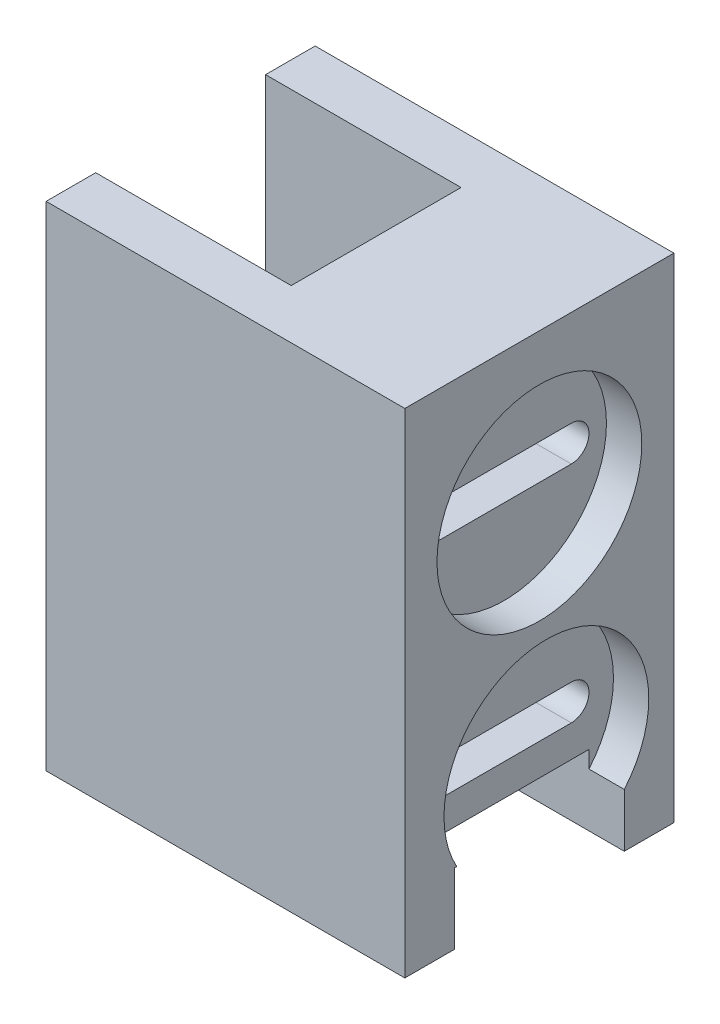
from build123d import *

# Parameters (mm, degrees)
SKETCH1_W           = 10.16
SKETCH1_H           = 7.62
BOSS_EXTRUDE1_DEPTH = 13.97
SKETCH2_R           = 2.9
CUT_EXTRUDE1_DEPTH  = 1
CUT_EXTRUDE2_REACH  = 20.88
SKETCH3_W           = 4.81
SKETCH3_H           = 2
SKETCH5_W           = 4.81
SKETCH5_H           = 4.22
CUT_EXTRUDE4_DEPTH  = 5.5372
SKETCH6_W           = 4.81
SKETCH6_H           = 10.57
CUT_EXTRUDE6_DEPTH  = 2.9972
SKETCH7_W           = 4.81
SKETCH7_H           = 3.4
CUT_EXTRUDE7_DEPTH  = 5.5372


with BuildPart() as part:
    # Sketch1 → Boss-Extrude1 (new body)
    with BuildSketch(Plane(origin=(0, 0, 0), x_dir=(1, 0, 0), z_dir=(0, 1, 0))):
        with Locations((5.08, 3.81)):
            Rectangle(SKETCH1_W, SKETCH1_H)
    extrude(amount=BOSS_EXTRUDE1_DEPTH)

    # Sketch2 → Cut-Extrude1 (cut)
    with BuildSketch(Plane(origin=(10.16, 0, 0), x_dir=(0, 0, -1), z_dir=(1, 0, 0))):
        with Locations((4.008616611, 3.4)):
            Circle(SKETCH2_R)
        with Locations((3.81, 9.75)):
            Circle(SKETCH2_R)
    extrude(amount=-CUT_EXTRUDE1_DEPTH, mode=Mode.SUBTRACT)

    # Sketch3 → Cut-Extrude2 (cut, up to next)
    with BuildSketch(Plane(origin=(10.16, 0, 0), x_dir=(0, 0, -1), z_dir=(1, 0, 0)), mode=Mode.PRIVATE) as cut_extrude2_sk1:
        with BuildLine():
            Line((1.905, 3.9), (5.715, 3.9))
            ThreePointArc((5.715, 3.9), (6.215, 3.4), (5.715, 2.9))
            Line((5.715, 2.9), (1.905, 2.9))
            ThreePointArc((1.905, 2.9), (1.405, 3.4), (1.905, 3.9))
        make_face()
    cut_extrude2_tool1 = extrude(cut_extrude2_sk1.sketch, amount=-CUT_EXTRUDE2_REACH, mode=Mode.PRIVATE) & part.part
    # Sketch3 → Cut-Extrude2 (cut, up to next)
    with BuildSketch(Plane(origin=(10.16, 0, 0), x_dir=(0, 0, -1), z_dir=(1, 0, 0)), mode=Mode.PRIVATE) as cut_extrude2_sk2:
        with BuildLine():
            Line((1.905, 10.25), (5.715, 10.25))
            ThreePointArc((5.715, 10.25), (6.215, 9.75), (5.715, 9.25))
            Line((5.715, 9.25), (1.905, 9.25))
            ThreePointArc((1.905, 9.25), (1.405, 9.75), (1.905, 10.25))
        make_face()
    cut_extrude2_tool2 = extrude(cut_extrude2_sk2.sketch, amount=-CUT_EXTRUDE2_REACH, mode=Mode.PRIVATE) & part.part
    # Sketch3 → Cut-Extrude2 (cut, up to next)
    with BuildSketch(Plane(origin=(10.16, 0, 0), x_dir=(0, 0, -1), z_dir=(1, 0, 0)), mode=Mode.PRIVATE) as cut_extrude2_sk3:
        with Locations((3.81, 1)):
            Rectangle(SKETCH3_W, SKETCH3_H)
    cut_extrude2_tool3 = extrude(cut_extrude2_sk3.sketch, amount=-CUT_EXTRUDE2_REACH, mode=Mode.PRIVATE) & part.part
    add(cut_extrude2_tool1.solids().sort_by_distance((10.16, 3.4, -3.81))[0], mode=Mode.SUBTRACT)
    add(cut_extrude2_tool2.solids().sort_by_distance((10.16, 9.75, -3.81))[0], mode=Mode.SUBTRACT)
    add(cut_extrude2_tool3.solids().sort_by_distance((10.16, 1, -3.81))[0], mode=Mode.SUBTRACT)

    # Sketch5 → Cut-Extrude4 (cut)
    with BuildSketch(Plane.ZY):
        with Locations((-3.81, 11.86)):
            Rectangle(SKETCH5_W, SKETCH5_H)
    extrude(amount=-CUT_EXTRUDE4_DEPTH, mode=Mode.SUBTRACT)

    # Sketch6 → Cut-Extrude6 (cut)
    with BuildSketch(Plane.ZY):
        with Locations((-3.81, 8.685)):
            Rectangle(SKETCH6_W, SKETCH6_H)
    extrude(amount=-CUT_EXTRUDE6_DEPTH, mode=Mode.SUBTRACT)

    # Sketch7 → Cut-Extrude7 (cut)
    with BuildSketch(Plane.ZY):
        with Locations((-3.81, 1.7)):
            Rectangle(SKETCH7_W, SKETCH7_H)
    extrude(amount=-CUT_EXTRUDE7_DEPTH, mode=Mode.SUBTRACT)


solid = part.part
